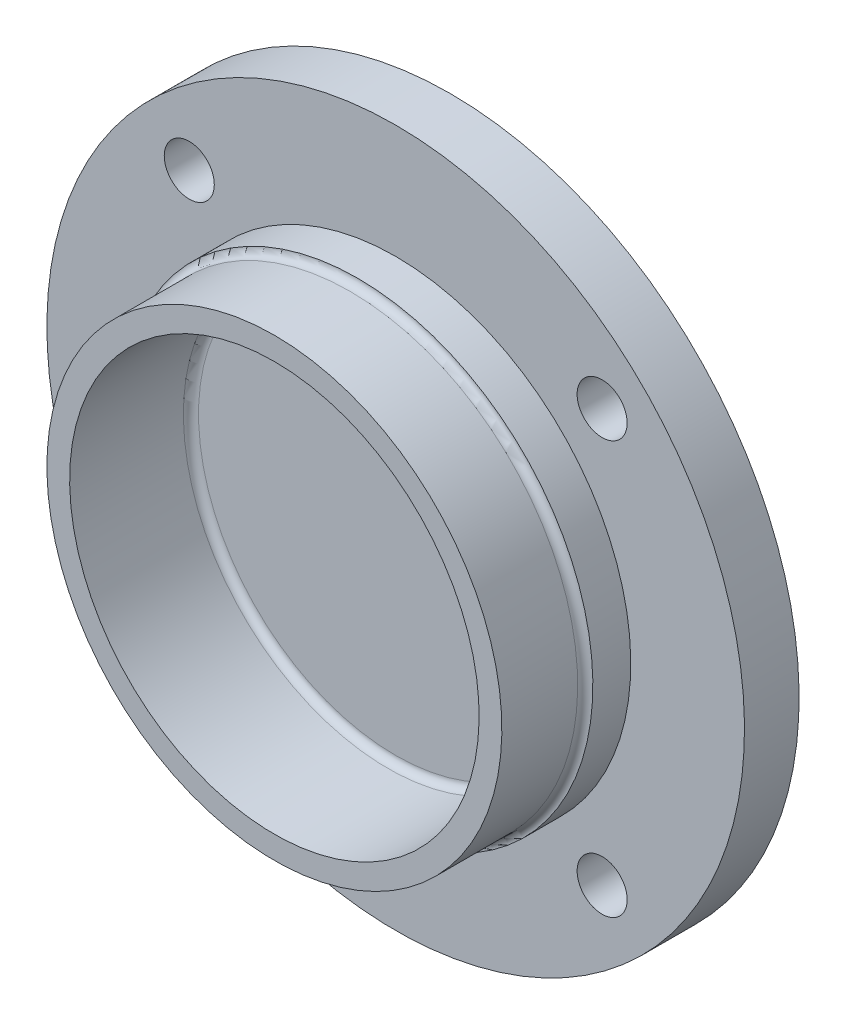
from build123d import *

# Parameters (mm, degrees)
M6_CLEARANCE_HOLE1_D = 6.6
CIRPATTERN1_COUNT    = 4


with BuildPart() as part:
    # Sketch1 → Revolve1 (revolve)
    with BuildSketch(Plane(origin=(0, 0, 0), x_dir=(0, 0, -1), z_dir=(1, 0, 0))):
        with BuildLine():
            Line((0, 0), (0, 26))
            ThreePointArc((0, 26), (-0.292893219, 26.707106781), (-1, 27))
            Line((-1, 27), (-16, 27))
            Line((-16, 27), (-16, 30))
            Line((-16, 30), (-6, 30))
            ThreePointArc((-6, 30), (-5.292893219, 30.292893219), (-5, 31))
            Line((-5, 31), (0, 31))
            Line((0, 31), (0, 46))
            Line((0, 46), (7.2, 46))
            Line((7.2, 46), (7.2, 31))
            Line((7.2, 31), (5.2, 29))
            Line((5.2, 29), (5.2, 0))
            Line((5.2, 0), (0, 0))
        make_face()
    revolve(axis=Axis((0, 0, -7.2), (0, 0, 1)))

    # M6 Clearance Hole1 (through all)
    with Locations(Plane(origin=(0, 0, -7.2), x_dir=(-1, 0, 0), z_dir=(0, 0, -1))):
        with Locations((27.223611076, 27.223611076)):
            m6_clearance_hole1 = Hole(M6_CLEARANCE_HOLE1_D / 2)

    # CirPattern1: M6 Clearance Hole1 ×4 about axis
    cirpattern1_axis = Axis((0, 0, 0), (0, 0, 1))
    for i in range(1, CIRPATTERN1_COUNT):
        add(m6_clearance_hole1.rotate(cirpattern1_axis, i * 360 / CIRPATTERN1_COUNT), mode=Mode.SUBTRACT)


solid = part.part
